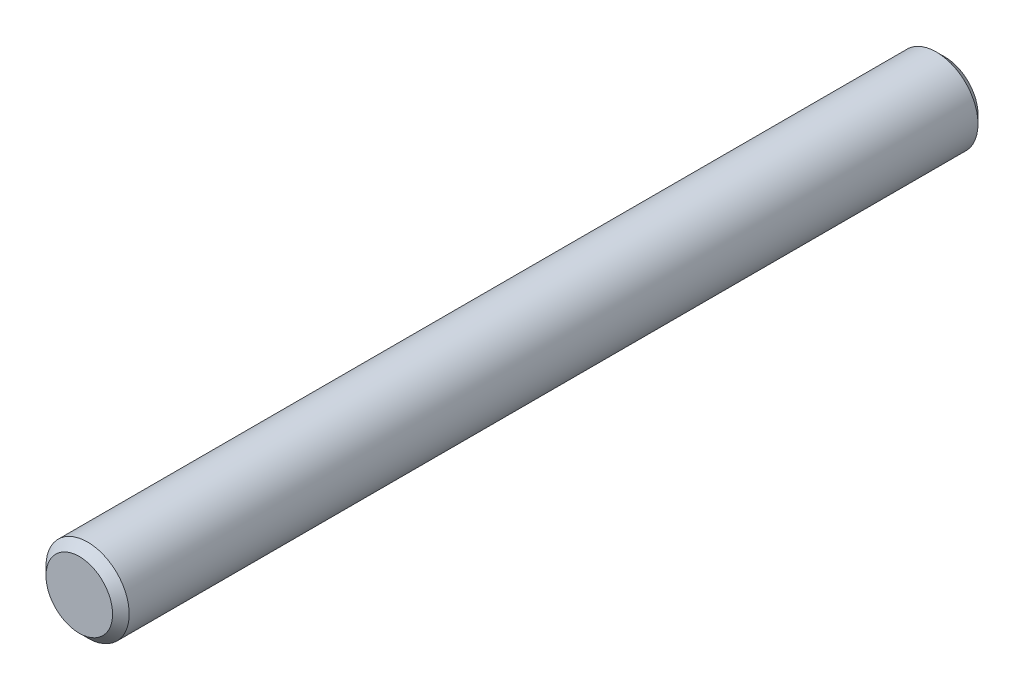
from build123d import *

# Parameters (mm, degrees)
SKETCH1_R           = 2.5
BOSS_EXTRUDE1_DEPTH = 52
CHAMFER1_SIZE       = 0.5


with BuildPart() as part:
    # Sketch1 → Boss-Extrude1 (new body)
    with BuildSketch(Plane.XY):
        with Locations(Location((0, 0, 0), (0, 0, 180))):
            Circle(SKETCH1_R)
    extrude(amount=BOSS_EXTRUDE1_DEPTH)

    # Chamfer1
    chamfer1_edges = [part.edges().sort_by_distance(p)[0] for p in [
        (2.5, 0, 0),
        (2.5, 0, 52),
    ]]
    chamfer(chamfer1_edges, length=CHAMFER1_SIZE)


solid = part.part
